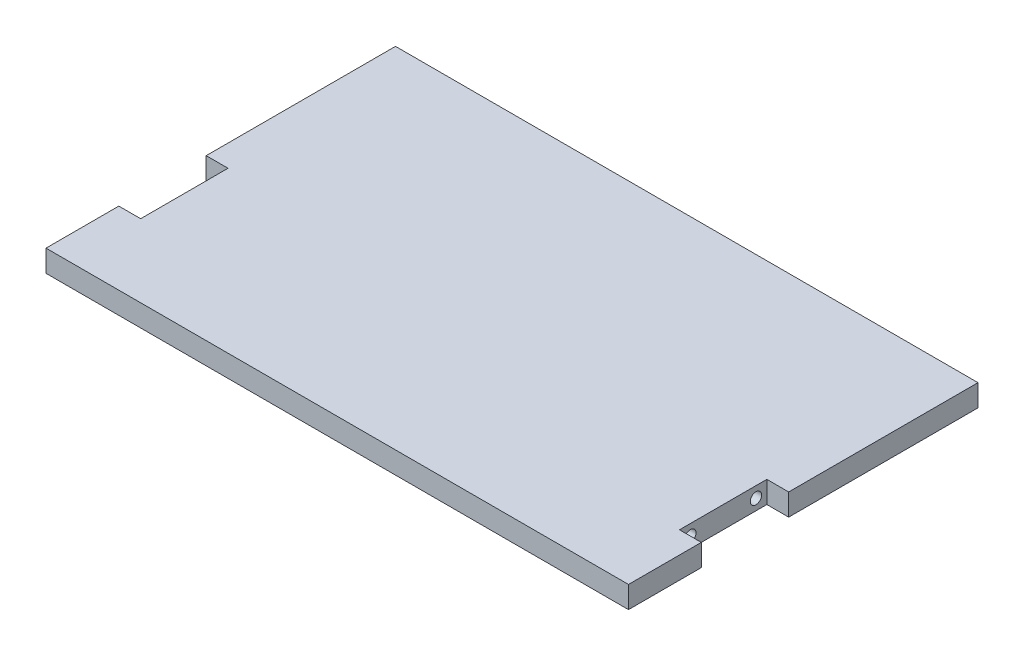
from build123d import *

# Parameters (mm, degrees)
SKETCH1_W                        = 254
SKETCH1_H                        = 254
BOSS_EXTRUDE1_DEPTH              = 9.525
SKETCH7_W                        = 9.525
SKETCH7_H                        = 38.1
CUT_EXTRUDE4_DEPTH               = 180.857514786
F_10_0_1935_DIAMETER_HOLE1_D     = 4.9149
F_10_0_1935_DIAMETER_HOLE1_DEPTH = 12.7
F_10_0_1935_DIAMETER_HOLE1_TIP   = 1.476584928
F_10_0_1935_DIAMETER_HOLE3_D     = 4.9149
F_10_0_1935_DIAMETER_HOLE3_DEPTH = 12.7
F_10_0_1935_DIAMETER_HOLE3_TIP   = 1.476584928
SKETCH16_W                       = 254
SKETCH16_H                       = 101.6
CUT_EXTRUDE5_DEPTH               = 180.857514786


with BuildPart() as part:
    # Sketch1 → Boss-Extrude1 (new body)
    with BuildSketch(Plane(origin=(0, 0, 0), x_dir=(1, 0, 0), z_dir=(0, 1, 0))):
        Rectangle(SKETCH1_W, SKETCH1_H)
    extrude(amount=BOSS_EXTRUDE1_DEPTH)

    # Sketch7 → Cut-Extrude4 (cut, through all)
    with BuildSketch(Plane(origin=(0, 9.525, 0), x_dir=(1, 0, 0), z_dir=(0, 1, 0))):
        with Locations((-122.2375, 25.4)):
            Rectangle(SKETCH7_W, SKETCH7_H)
        with Locations((122.2375, 25.4)):
            Rectangle(SKETCH7_W, SKETCH7_H)
    extrude(amount=-CUT_EXTRUDE4_DEPTH, mode=Mode.SUBTRACT)

    # #10 (0.1935) Diameter Hole1
    with Locations(Plane(origin=(117.475, 0, 0), x_dir=(0, 0, -1), z_dir=(1, 0, 0))):
        with Locations((11.1125, 4.7625), (39.6875, 4.7625)):
            Hole(F_10_0_1935_DIAMETER_HOLE1_D / 2, depth=F_10_0_1935_DIAMETER_HOLE1_DEPTH)
            with Locations((0, 0, -(F_10_0_1935_DIAMETER_HOLE1_DEPTH + F_10_0_1935_DIAMETER_HOLE1_TIP / 2))):  # 118° drill point
                Cone(0, F_10_0_1935_DIAMETER_HOLE1_D / 2, F_10_0_1935_DIAMETER_HOLE1_TIP, mode=Mode.SUBTRACT)

    # #10 (0.1935) Diameter Hole3
    with Locations(Plane.ZY.offset(117.475)):
        with Locations((-39.6875, 4.7625), (-11.1125, 4.7625)):
            Hole(F_10_0_1935_DIAMETER_HOLE3_D / 2, depth=F_10_0_1935_DIAMETER_HOLE3_DEPTH)
            with Locations((0, 0, -(F_10_0_1935_DIAMETER_HOLE3_DEPTH + F_10_0_1935_DIAMETER_HOLE3_TIP / 2))):  # 118° drill point
                Cone(0, F_10_0_1935_DIAMETER_HOLE3_D / 2, F_10_0_1935_DIAMETER_HOLE3_TIP, mode=Mode.SUBTRACT)

    # Sketch16 → Cut-Extrude5 (cut, through all)
    with BuildSketch(Plane(origin=(0, 9.525, 0), x_dir=(1, 0, 0), z_dir=(0, 1, 0))):
        with Locations((0, -76.2)):
            Rectangle(SKETCH16_W, SKETCH16_H)
    extrude(amount=-CUT_EXTRUDE5_DEPTH, mode=Mode.SUBTRACT)


solid = part.part
